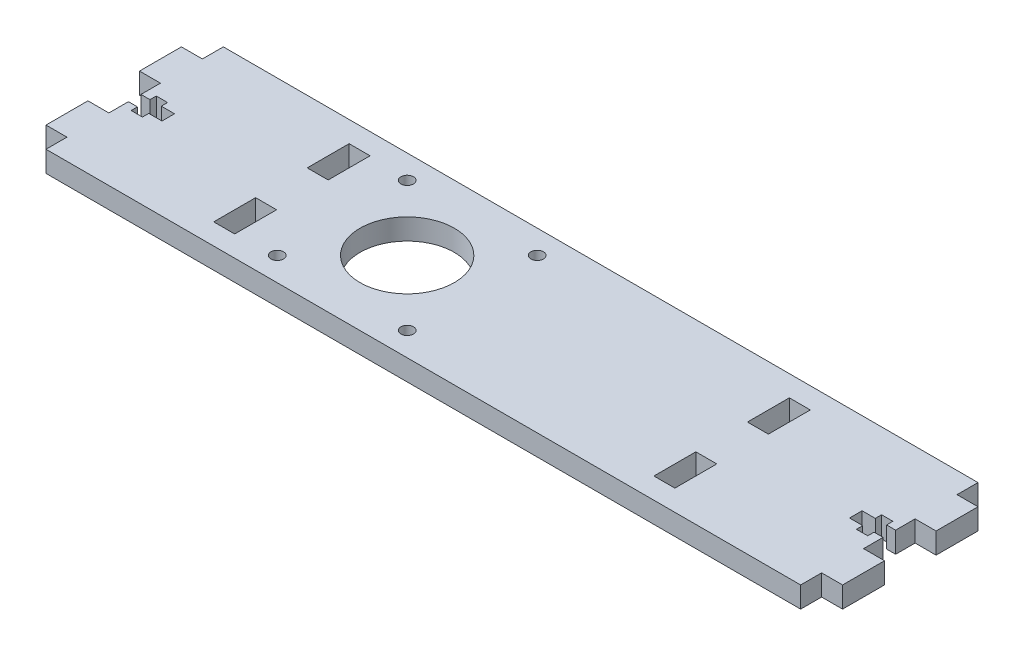
from build123d import *

# Parameters (mm, degrees)
SKETCH_1_R      = 11.25
SKETCH_1_R_2    = 1.5
SKETCH_1_W      = 5
SKETCH_1_H      = 10
EXTRUDE_1_DEPTH = 5


with BuildPart() as part:
    # 草图1 → 凸台-拉伸1 (new body)
    with BuildSketch(Plane(origin=(0, 0, 0), x_dir=(1, 0, 0), z_dir=(0, 1, 0))):
        Polygon((0, 0), (180, 0), (180, 5), (185, 5), (185, 15), (180, 15), (180, 19.659044965), (177.85, 19.659044965), (177.85, 18.15), (175.15, 18.15), (175.15, 19.659044965), (172, 19.659044965), (172, 22.65), (175.15, 22.65), (175.15, 24.15), (177.85, 24.15), (177.85, 22.65), (180, 22.65), (180, 27.3), (185, 27.3), (185, 37.3), (180, 37.3), (180, 42.3), (99, 42.3), (81, 42.3), (0, 42.3), (0, 37.3), (-5, 37.3), (-5, 27.3), (0, 27.3), (0, 22.65), (2.15, 22.65), (2.15, 24.15), (4.85, 24.15), (4.85, 22.65), (8, 22.65), (8, 19.659044965), (4.85, 19.659044965), (4.85, 18.15), (2.15, 18.15), (2.15, 19.659044965), (0, 19.659044965), (0, 15), (-5, 15), (-5, 5), (0, 5), align=None)
        with Locations(Location((65, 21.15, 0), (0, 0, 270))):
            Circle(SKETCH_1_R, mode=Mode.SUBTRACT)
        with Locations(Location((49.5, 36.65, 0), (0, 0, 270))):
            Circle(SKETCH_1_R_2, mode=Mode.SUBTRACT)
        with Locations(Location((80.5, 36.65, 0), (0, 0, 270))):
            Circle(SKETCH_1_R_2, mode=Mode.SUBTRACT)
        with Locations(Location((80.5, 5.65, 0), (0, 0, 270))):
            Circle(SKETCH_1_R_2, mode=Mode.SUBTRACT)
        with Locations(Location((49.5, 5.65, 0), (0, 0, 270))):
            Circle(SKETCH_1_R_2, mode=Mode.SUBTRACT)
        with Locations((37.5, 32.3)):
            Rectangle(SKETCH_1_W, SKETCH_1_H, mode=Mode.SUBTRACT)
        with Locations((37.5, 10)):
            Rectangle(SKETCH_1_W, SKETCH_1_H, mode=Mode.SUBTRACT)
        with Locations((142.5, 32.3)):
            Rectangle(SKETCH_1_W, SKETCH_1_H, mode=Mode.SUBTRACT)
        with Locations((142.5, 10)):
            Rectangle(SKETCH_1_W, SKETCH_1_H, mode=Mode.SUBTRACT)
    extrude(amount=EXTRUDE_1_DEPTH)


solid = part.part
